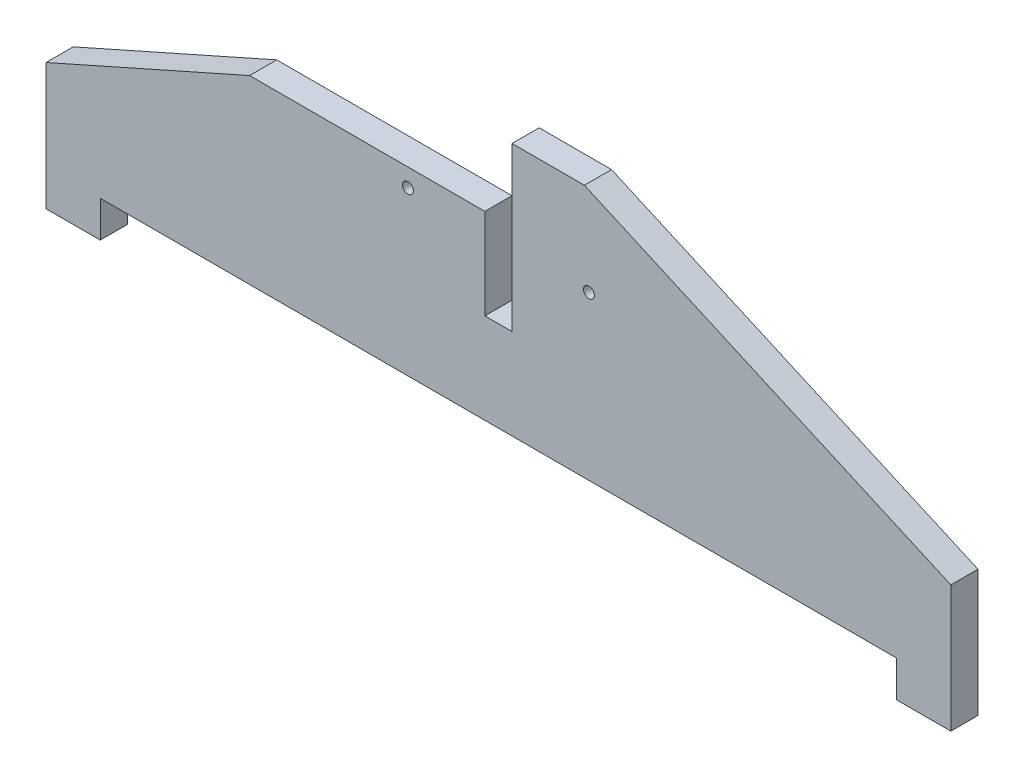
from build123d import *

# Parameters (mm, degrees)
ESQUISSE1_R        = 3
BOSS_EXTRU_1_DEPTH = 15


with BuildPart() as part:
    # Esquisse1 → Boss.-Extru.1 (new body)
    with BuildSketch(Plane.XY):
        Polygon((0, 0), (30, 0), (30, 20), (470, 20), (470, 0), (500, 0), (500, 70), (297.5, 160), (257.5, 160), (257.5, 70), (242.5, 70), (242.5, 120), (112.5, 120), (0, 70), align=None)
        with Locations((200, 110)):
            Circle(ESQUISSE1_R, mode=Mode.SUBTRACT)
        with Locations((300, 110)):
            Circle(ESQUISSE1_R, mode=Mode.SUBTRACT)
    extrude(amount=BOSS_EXTRU_1_DEPTH)


solid = part.part
